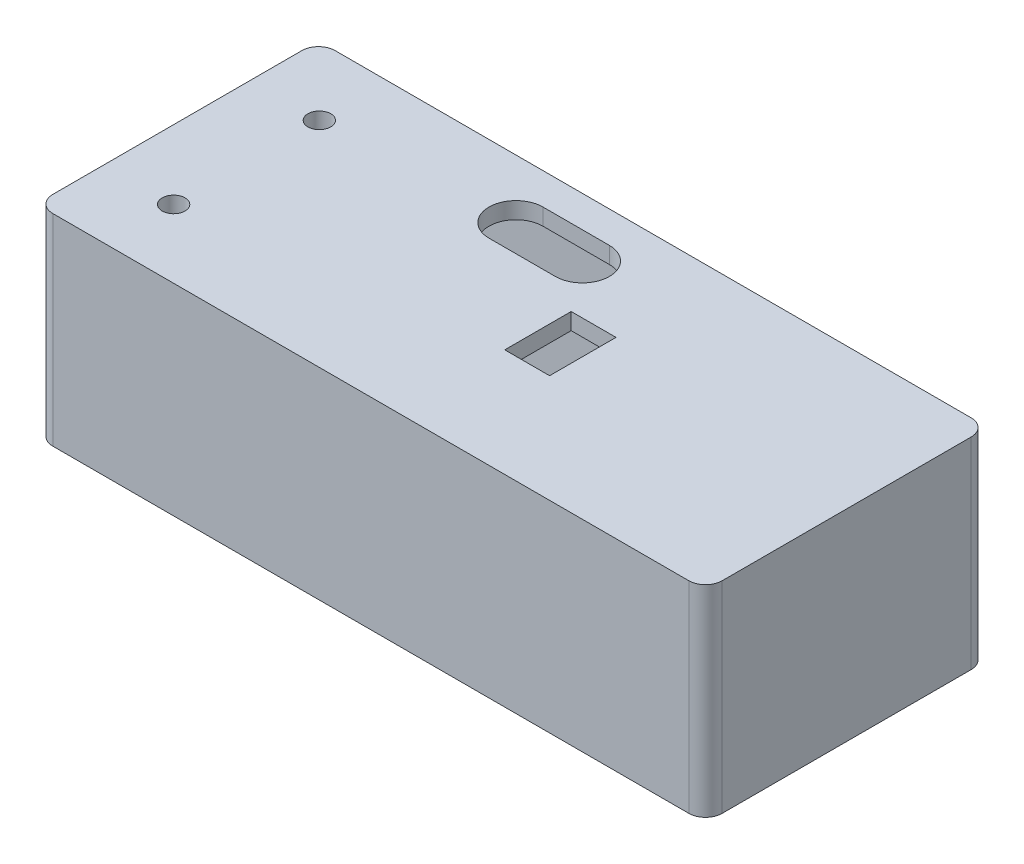
from build123d import *

# Parameters (mm, degrees)
BOSS_EXTRUDE1_DEPTH = 28.2829
BOSS_EXTRUDE2_DEPTH = 2.54
CUT_EXTRUDE1_REACH  = 125.911
SKETCH3_R           = 1.75
SKETCH4_W           = 7.62
SKETCH4_H           = 6.985
BOSS_EXTRUDE3_DEPTH = 3.81
CUT_EXTRUDE2_REACH  = 126.168
SKETCH6_W           = 6.858000092
SKETCH6_H           = 10.16
CUT_EXTRUDE3_REACH  = 126.168


with BuildPart() as part:
    # Sketch1 → Boss-Extrude1 (new body)
    with BuildSketch(Plane(origin=(0, 35.474386892, 0), x_dir=(1, 0, 0), z_dir=(0, 1, 0))):
        with BuildLine():
            Line((-17.013975249, -86.850733206), (80.290024751, -86.850733206))
            ThreePointArc((80.290024751, -86.850733206), (82.086075975, -86.10678443), (82.830024751, -84.310733206))
            Line((82.830024751, -84.310733206), (82.830024751, -46.210733206))
            ThreePointArc((82.830024751, -46.210733206), (82.086075975, -44.414681982), (80.290024751, -43.670733206))
            Line((80.290024751, -43.670733206), (-17.013975249, -43.670733206))
            ThreePointArc((-17.013975249, -43.670733206), (-18.810026474, -44.414681982), (-19.553975249, -46.210733206))
            Line((-19.553975249, -46.210733206), (-19.553975249, -84.310733206))
            ThreePointArc((-19.553975249, -84.310733206), (-18.810026474, -86.10678443), (-17.013975249, -86.850733206))
        make_face()
        Polygon((78.258024751, -82.405733206), (78.258024751, -48.115733206), (-6.791975249, -48.115733206), (-11.171975249, -48.115733206), (-14.981975249, -48.115733206), (-14.981975249, -51.115733206), (-14.981975249, -54.115733206), (-14.981975249, -76.405733206), (-14.981975249, -79.405733206), (-14.981975249, -82.405733206), (-11.171975249, -82.405733206), (-6.791975249, -82.405733206), align=None, mode=Mode.SUBTRACT)
    extrude(amount=BOSS_EXTRUDE1_DEPTH)

    # Sketch2 → Boss-Extrude2 (add)
    with BuildSketch(Plane(origin=(0, 63.757286892, 0), x_dir=(1, 0, 0), z_dir=(0, 1, 0))):
        with BuildLine():
            Line((-17.013975249, -86.850733206), (80.290024751, -86.850733206))
            ThreePointArc((80.290024751, -86.850733206), (82.086075975, -86.10678443), (82.830024751, -84.310733206))
            Line((82.830024751, -84.310733206), (82.830024751, -46.210733206))
            ThreePointArc((82.830024751, -46.210733206), (82.086075975, -44.414681982), (80.290024751, -43.670733206))
            Line((80.290024751, -43.670733206), (-17.013975249, -43.670733206))
            ThreePointArc((-17.013975249, -43.670733206), (-18.810026474, -44.414681982), (-19.553975249, -46.210733206))
            Line((-19.553975249, -46.210733206), (-19.553975249, -84.310733206))
            ThreePointArc((-19.553975249, -84.310733206), (-18.810026474, -86.10678443), (-17.013975249, -86.850733206))
        make_face()
    extrude(amount=BOSS_EXTRUDE2_DEPTH)

    # Sketch3 → Cut-Extrude1 (cut, up to next)
    with BuildSketch(Plane(origin=(0, 66.297286892, 0), x_dir=(1, 0, 0), z_dir=(0, 1, 0)), mode=Mode.PRIVATE) as cut_extrude1_sk1:
        with Locations(Location((-8.981975249, -54.115733206, 0), (0, 0, 270))):
            Circle(SKETCH3_R)
    cut_extrude1_tool1 = extrude(cut_extrude1_sk1.sketch, amount=-CUT_EXTRUDE1_REACH, mode=Mode.PRIVATE) & part.part
    # Sketch3 → Cut-Extrude1 (cut, up to next)
    with BuildSketch(Plane(origin=(0, 66.297286892, 0), x_dir=(1, 0, 0), z_dir=(0, 1, 0)), mode=Mode.PRIVATE) as cut_extrude1_sk2:
        with Locations(Location((-8.981975249, -76.405733206, 0), (0, 0, 270))):
            Circle(SKETCH3_R)
    cut_extrude1_tool2 = extrude(cut_extrude1_sk2.sketch, amount=-CUT_EXTRUDE1_REACH, mode=Mode.PRIVATE) & part.part
    add(cut_extrude1_tool1.solids().sort_by_distance((-8.981975, 66.297287, 54.115733))[0], mode=Mode.SUBTRACT)
    add(cut_extrude1_tool2.solids().sort_by_distance((-8.981975, 66.297287, 76.405733))[0], mode=Mode.SUBTRACT)

    # Sketch4 → Boss-Extrude3 (add)
    with BuildSketch(Plane.XY.offset(48.115733206)):
        with Locations((74.448024751, 37.950886892)):
            Rectangle(SKETCH4_W, SKETCH4_H)
    boss_extrude3 = extrude(amount=BOSS_EXTRUDE3_DEPTH)

    # Mirror1: Boss-Extrude3 across plane
    add(boss_extrude3.mirror(Plane.XY.offset(65.260733206)))

    # Sketch6 → Cut-Extrude2 (cut, up to next)
    with BuildSketch(Plane(origin=(0, 66.297286892, 0), x_dir=(1, 0, 0), z_dir=(0, 1, 0)), mode=Mode.PRIVATE) as cut_extrude2_sk1:
        with Locations((39.039024705, -65.260733206)):
            Rectangle(SKETCH6_W, SKETCH6_H)
    cut_extrude2_tool1 = extrude(cut_extrude2_sk1.sketch, amount=-CUT_EXTRUDE2_REACH, mode=Mode.PRIVATE) & part.part
    add(cut_extrude2_tool1.solids().sort_by_distance((39.039025, 66.297287, 65.260733))[0], mode=Mode.SUBTRACT)

    # Sketch7 → Cut-Extrude3 (cut, up to next)
    with BuildSketch(Plane(origin=(0, 66.297286892, 0), x_dir=(1, 0, 0), z_dir=(0, 1, 0)), mode=Mode.PRIVATE) as cut_extrude3_sk1:
        with BuildLine():
            Line((29.768024751, -56.751733206), (19.608024751, -56.751733206))
            ThreePointArc((19.608024751, -56.751733206), (15.480524751, -52.624233206), (19.608024751, -48.496733206))
            Line((19.608024751, -48.496733206), (29.768024751, -48.496733206))
            ThreePointArc((29.768024751, -48.496733206), (33.895524751, -52.624233206), (29.768024751, -56.751733206))
        make_face()
    cut_extrude3_tool1 = extrude(cut_extrude3_sk1.sketch, amount=-CUT_EXTRUDE3_REACH, mode=Mode.PRIVATE) & part.part
    add(cut_extrude3_tool1.solids().sort_by_distance((24.688025, 66.297287, 52.624233))[0], mode=Mode.SUBTRACT)


solid = part.part
